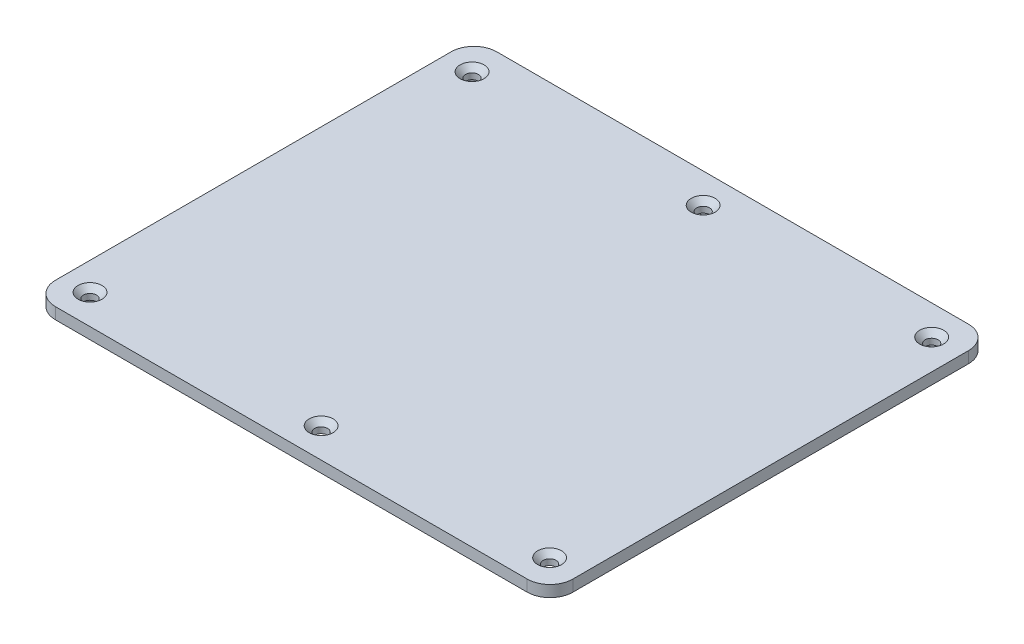
from build123d import *

# Parameters (mm, degrees)
BOSS_EXTRUDE1_DEPTH                                 = 3
BOSS_EXTRUDE2_DEPTH                                 = 5
CSK_FOR_M3_COUNTERSUNK_FLAT_HEAD_SCREW1_D           = 3.4
CSK_FOR_M3_COUNTERSUNK_FLAT_HEAD_SCREW1_DEPTH       = 6
CSK_FOR_M3_COUNTERSUNK_FLAT_HEAD_SCREW1_CSINK_D     = 6.3
CSK_FOR_M3_COUNTERSUNK_FLAT_HEAD_SCREW1_CSINK_ANGLE = 90
CSK_FOR_M3_COUNTERSUNK_FLAT_HEAD_SCREW1_TIP         = 1.021463052


with BuildPart() as part:
    # Sketch1 → Boss-Extrude1 (new body)
    with BuildSketch(Plane(origin=(0, 0, 0), x_dir=(1, 0, 0), z_dir=(0, 1, 0))):
        with BuildLine():
            Line((62, -58), (-62, -58))
            ThreePointArc((-62, -58), (-66.242640687, -56.242640687), (-68, -52))
            Line((-68, -52), (-68, 52))
            ThreePointArc((-68, 52), (-66.242640687, 56.242640687), (-62, 58))
            Line((-62, 58), (62, 58))
            ThreePointArc((62, 58), (66.242640687, 56.242640687), (68, 52))
            Line((68, 52), (68, -52))
            ThreePointArc((68, -52), (66.242640687, -56.242640687), (62, -58))
        make_face()
    extrude(amount=BOSS_EXTRUDE1_DEPTH)

    # Sketch2 → Boss-Extrude2 (add)
    with BuildSketch(Plane(origin=(0, 3, 0), x_dir=(1, 0, 0), z_dir=(0, 1, 0))):
        with BuildLine():
            Line((-61.84, 54.84), (61.84, 54.84))
            ThreePointArc((61.84, 54.84), (63.961320344, 53.961320344), (64.84, 51.84))
            Line((64.84, 51.84), (64.84, -51.84))
            ThreePointArc((64.84, -51.84), (63.961320344, -53.961320344), (61.84, -54.84))
            Line((61.84, -54.84), (-61.84, -54.84))
            ThreePointArc((-61.84, -54.84), (-63.961320344, -53.961320344), (-64.84, -51.84))
            Line((-64.84, -51.84), (-64.84, 51.84))
            ThreePointArc((-64.84, 51.84), (-63.961320344, 53.961320344), (-61.84, 54.84))
        make_face()
        with BuildLine():
            Line((-62.84, 49.84), (-62.84, -49.84))
            ThreePointArc((-62.84, -49.84), (-61.961320344, -51.961320344), (-59.84, -52.84))
            Line((-59.84, -52.84), (59.84, -52.84))
            ThreePointArc((59.84, -52.84), (61.961320344, -51.961320344), (62.84, -49.84))
            Line((62.84, -49.84), (62.84, 49.84))
            ThreePointArc((62.84, 49.84), (61.961320344, 51.961320344), (59.84, 52.84))
            Line((59.84, 52.84), (-59.84, 52.84))
            ThreePointArc((-59.84, 52.84), (-61.961320344, 51.961320344), (-62.84, 49.84))
        make_face(mode=Mode.SUBTRACT)
    extrude(amount=-BOSS_EXTRUDE2_DEPTH)

    # CSK for M3 Countersunk Flat Head Screw1
    with Locations(Plane(origin=(-60.7, 3, -50.2), x_dir=(0, 0, 1), z_dir=(0, 1, 0))):
        with Locations((0, 0), (0, 60.74), (0, 120.79), (100.4, 0), (100.4, 60.74), (100.4, 120.79)):
            CounterSinkHole(CSK_FOR_M3_COUNTERSUNK_FLAT_HEAD_SCREW1_D / 2, CSK_FOR_M3_COUNTERSUNK_FLAT_HEAD_SCREW1_CSINK_D / 2, depth=CSK_FOR_M3_COUNTERSUNK_FLAT_HEAD_SCREW1_DEPTH, counter_sink_angle=CSK_FOR_M3_COUNTERSUNK_FLAT_HEAD_SCREW1_CSINK_ANGLE)
            with Locations((0, 0, -(CSK_FOR_M3_COUNTERSUNK_FLAT_HEAD_SCREW1_DEPTH + CSK_FOR_M3_COUNTERSUNK_FLAT_HEAD_SCREW1_TIP / 2))):  # 118° drill point
                Cone(0, CSK_FOR_M3_COUNTERSUNK_FLAT_HEAD_SCREW1_D / 2, CSK_FOR_M3_COUNTERSUNK_FLAT_HEAD_SCREW1_TIP, mode=Mode.SUBTRACT)


solid = part.part
